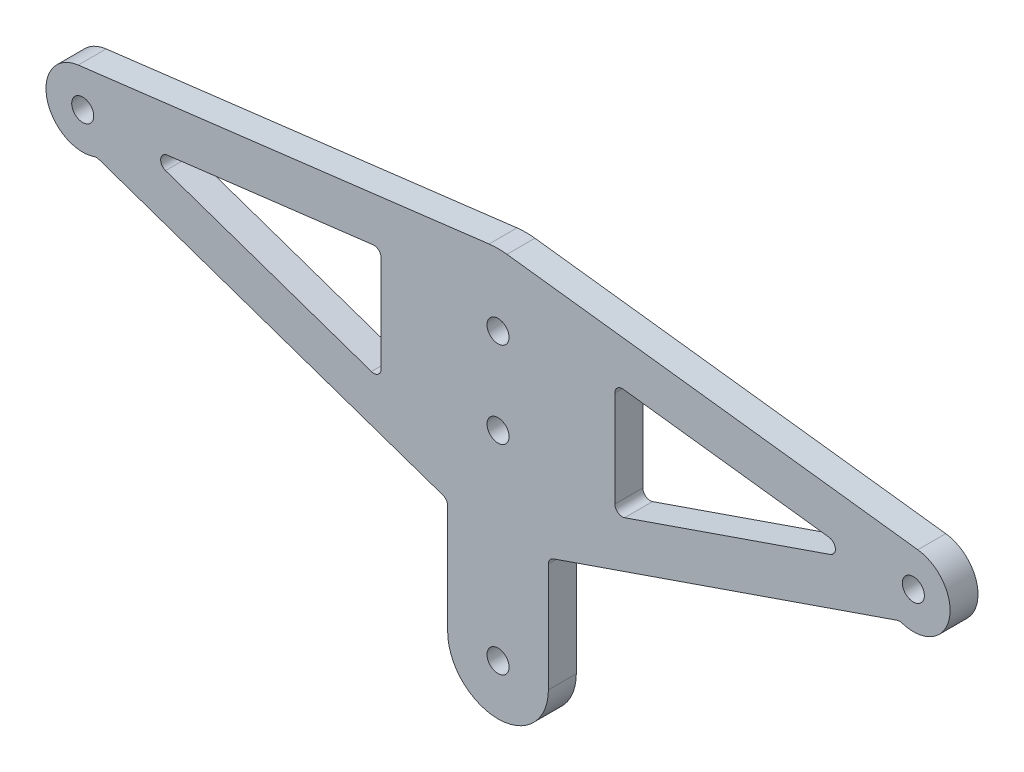
from build123d import *

# Parameters (mm, degrees)
ESBO_O2_R                = 1.5
RESSALTO_EXTRUS_O1_DEPTH = 3.8
FILETE1_R                = 10


with BuildPart() as part:
    # Esboço2 → Ressalto-extrusão1 (new body)
    with BuildSketch(Plane.XY):
        with BuildLine():
            Line((-0.609346717, 4.962730758), (56.5, 11.974876818))
            Line((56.5, 11.974876818), (113.609346717, 4.962730758))
            ThreePointArc((113.609346717, 4.962730758), (117.879129474, -1.092746803), (111.434372539, -4.748558798))
            ThreePointArc((111.434372539, -4.748558798), (111.114278546, -4.698294837), (110.794916153, -4.753014958))
            Line((110.794916153, -4.753014958), (64.023669106, -20.899867583))
            ThreePointArc((64.023669106, -20.899867583), (63.535650292, -21.264748688), (63.35, -21.845123182))
            Line((63.35, -21.845123182), (63.35, -36.675123182))
            ThreePointArc((63.35, -36.675123182), (56.5, -43.525123182), (49.65, -36.675123182))
            Line((49.65, -36.675123182), (49.65, -21.845123182))
            ThreePointArc((49.65, -21.845123182), (49.464349708, -21.264748688), (48.976330894, -20.899867583))
            Line((48.976330894, -20.899867583), (2.205083847, -4.753014958))
            ThreePointArc((2.205083847, -4.753014958), (1.885721454, -4.698294837), (1.565627461, -4.748558798))
            ThreePointArc((1.565627461, -4.748558798), (-4.879129474, -1.092746803), (-0.609346717, 4.962730758))
        make_face()
        with Locations(Location((0, 0, 0), (0, 0, 180))):
            Circle(ESBO_O2_R, mode=Mode.SUBTRACT)
        with Locations(Location((113, 0, 0), (0, 0, 180))):
            Circle(ESBO_O2_R, mode=Mode.SUBTRACT)
        with Locations(Location((56.5, 2.174876818, 0), (0, 0, 180))):
            Circle(ESBO_O2_R, mode=Mode.SUBTRACT)
        with Locations(Location((56.5, -9.525123182, 0), (0, 0, 180))):
            Circle(ESBO_O2_R, mode=Mode.SUBTRACT)
        with Locations(Location((56.5, -36.675123182, 0), (0, 0, 180))):
            Circle(ESBO_O2_R, mode=Mode.SUBTRACT)
        with BuildLine():
            Line((72.4, 2.847248961), (72.4, -10.257469431))
            ThreePointArc((72.4, -10.257469431), (72.819625506, -11.071819139), (73.726330894, -11.20272503))
            Line((73.726330894, -11.20272503), (101.726975538, -1.536053496))
            ThreePointArc((101.726975538, -1.536053496), (102.395124292, -0.485868251), (101.522513987, 0.401748255))
            Line((101.522513987, 0.401748255), (73.521869343, 3.839795112))
            ThreePointArc((73.521869343, 3.839795112), (72.737379952, 3.596204682), (72.4, 2.847248961))
        make_face(mode=Mode.SUBTRACT)
        with BuildLine():
            Line((11.477486013, 0.401748255), (39.478130657, 3.839795112))
            ThreePointArc((39.478130657, 3.839795112), (40.262620048, 3.596204682), (40.6, 2.847248961))
            Line((40.6, 2.847248961), (40.6, -10.257469431))
            ThreePointArc((40.6, -10.257469431), (40.180374494, -11.071819139), (39.273669106, -11.20272503))
            Line((39.273669106, -11.20272503), (11.273024462, -1.536053496))
            ThreePointArc((11.273024462, -1.536053496), (10.604875708, -0.485868251), (11.477486013, 0.401748255))
        make_face(mode=Mode.SUBTRACT)
    extrude(amount=RESSALTO_EXTRUS_O1_DEPTH)

    # Filete1
    filete1_edges = [part.edges().sort_by_distance(p)[0] for p in [
        (56.5, 11.974876818, 1.9),
    ]]
    fillet(filete1_edges, radius=FILETE1_R)


solid = part.part
